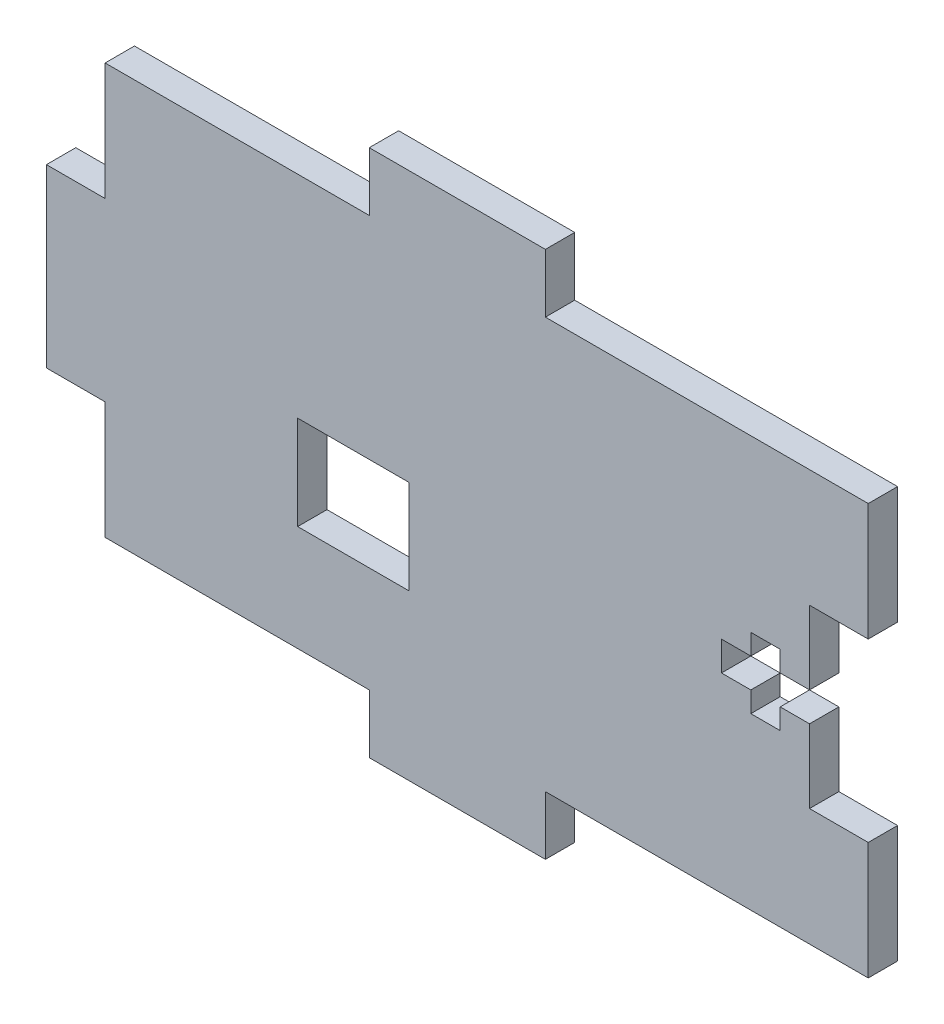
from build123d import *

# Parameters (mm, degrees)
SKETCH1_W           = 82.55
SKETCH1_H           = 44.45
BOSS_EXTRUDE1_DEPTH = 3.175
SKETCH2_W           = 6.35
SKETCH2_H           = 19.05
BOSS_EXTRUDE2_DEPTH = 3.175
SKETCH5_W           = 19.05
SKETCH5_H           = 6.35
BOSS_EXTRUDE3_DEPTH = 3.175
SKETCH3_W           = 6.35
SKETCH3_H           = 19.05
CUT_EXTRUDE1_DEPTH  = 3.175
SKETCH6_W           = 12.065
SKETCH6_H           = 10.16
CUT_EXTRUDE2_DEPTH  = 97.980529618
CUT_EXTRUDE3_DEPTH  = 97.980529618


with BuildPart() as part:
    # Sketch1 → Boss-Extrude1 (new body)
    with BuildSketch(Plane.XY):
        with Locations((41.275, 22.225)):
            Rectangle(SKETCH1_W, SKETCH1_H)
    extrude(amount=BOSS_EXTRUDE1_DEPTH)

    # Sketch2 → Boss-Extrude2 (add)
    with BuildSketch(Plane.XY.offset(3.175)):
        with Locations((-3.175, 22.225)):
            Rectangle(SKETCH2_W, SKETCH2_H)
    extrude(amount=-BOSS_EXTRUDE2_DEPTH)

    # Sketch5 → Boss-Extrude3 (add)
    with BuildSketch(Plane.XY.offset(3.175)):
        with Locations((38.1, 47.625)):
            Rectangle(SKETCH5_W, SKETCH5_H)
        with Locations((38.1, -3.175)):
            Rectangle(SKETCH5_W, SKETCH5_H)
    extrude(amount=-BOSS_EXTRUDE3_DEPTH)

    # Sketch3 → Cut-Extrude1 (cut)
    with BuildSketch(Plane.XY.offset(3.175)):
        with Locations((79.375, 22.225)):
            Rectangle(SKETCH3_W, SKETCH3_H)
    extrude(amount=-CUT_EXTRUDE1_DEPTH, mode=Mode.SUBTRACT)

    # Sketch6 → Cut-Extrude2 (cut, through all)
    with BuildSketch(Plane.XY.offset(3.175)):
        with Locations((26.8605, 16.51)):
            Rectangle(SKETCH6_W, SKETCH6_H)
    extrude(amount=-CUT_EXTRUDE2_DEPTH, mode=Mode.SUBTRACT)

    # Sketch7 → Cut-Extrude3 (cut, through all)
    with BuildSketch(Plane.XY.offset(3.175)):
        Polygon((69.85, 26.035), (73.025, 26.035), (73.025, 23.8125), (76.2, 23.8125), (76.2, 20.6375), (73.025, 20.6375), (73.025, 18.415), (69.85, 18.415), (69.85, 20.6375), (66.675, 20.6375), (66.675, 23.8125), (69.85, 23.8125), align=None)
    extrude(amount=-CUT_EXTRUDE3_DEPTH, mode=Mode.SUBTRACT)


solid = part.part
